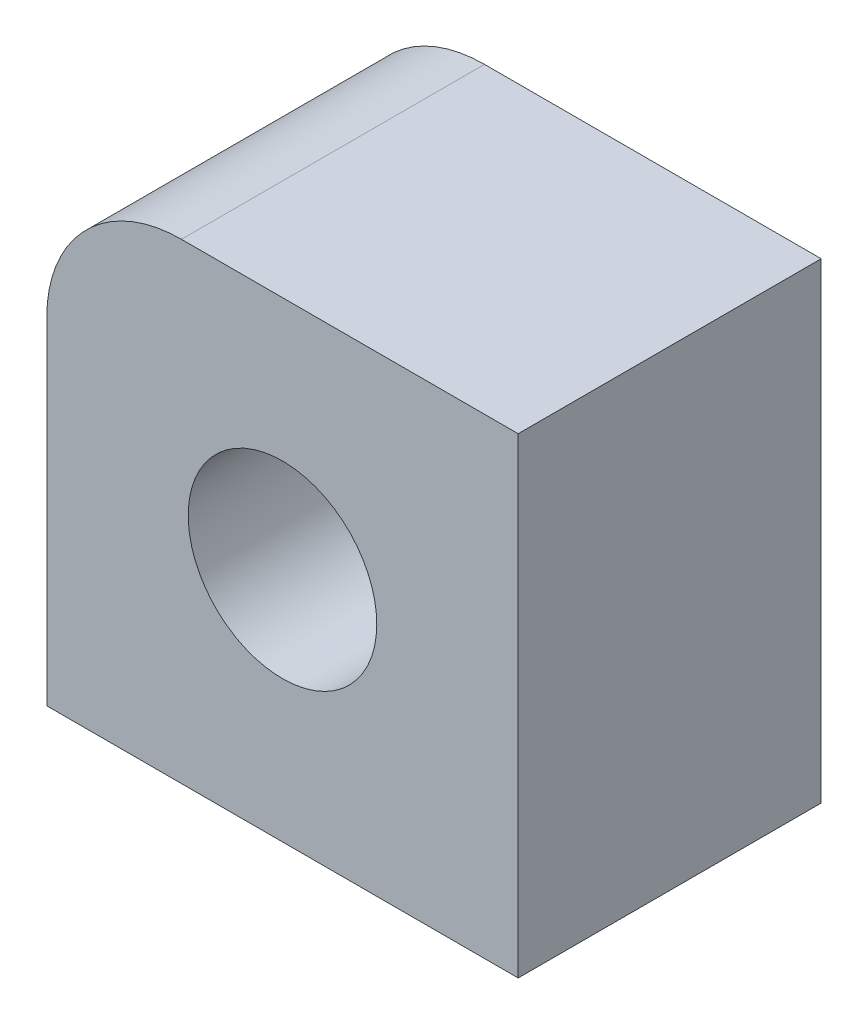
from build123d import *

# Parameters (mm, degrees)
SKETCH1_W           = 7
SKETCH1_H           = 7
BOSS_EXTRUDE1_DEPTH = 4.5
SKETCH2_R           = 1.4
CUT_EXTRUDE1_DEPTH  = 7.68954408
FILLET1_R           = 2


with BuildPart() as part:
    # Sketch1 → Boss-Extrude1 (new body)
    with BuildSketch(Plane.XY):
        Rectangle(SKETCH1_W, SKETCH1_H)
    extrude(amount=BOSS_EXTRUDE1_DEPTH)

    # Sketch2 → Cut-Extrude1 (cut, through all)
    with BuildSketch(Plane.XY.offset(4.5)):
        Circle(SKETCH2_R)
    extrude(amount=-CUT_EXTRUDE1_DEPTH, mode=Mode.SUBTRACT)

    # Fillet1
    fillet1_edges = [part.edges().sort_by_distance(p)[0] for p in [
        (-3.5, 3.5, 2.25),
    ]]
    fillet(fillet1_edges, radius=FILLET1_R)


solid = part.part
